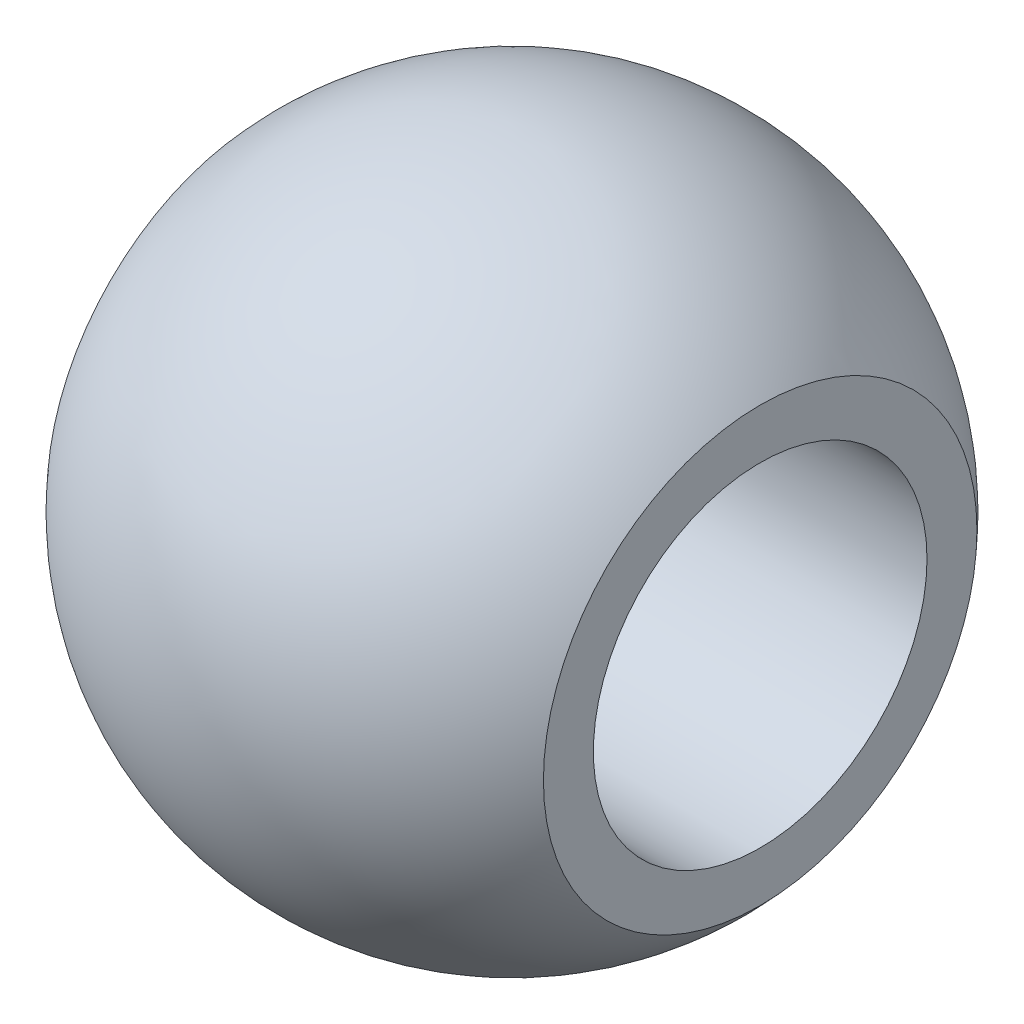
from build123d import *

# Parameters (mm, degrees)
CUT_EXTRUDE2_REACH = 19.794
SKETCH3_R          = 4


with BuildPart() as part:
    # Sketch1 → Revolve1 (revolve)
    with BuildSketch(Plane(origin=(0, 0, 0), x_dir=(0, 0, -1), z_dir=(1, 0, 0))):
        with BuildLine():
            Line((0, -7.9), (0, 0))
            Line((0, 0), (0, 7.9))
            ThreePointArc((0, 7.9), (-7.9, 0), (0, -7.9))
        make_face()
    revolve(axis=Axis((0, 0, 0), (0, 1, 0)))

    # SurfaceCut1
    split(bisect_by=Plane(origin=(5.95, 0, 0), x_dir=(0, 0, -1), z_dir=(1, 0, 0)), keep=Keep.BOTTOM)

    # SurfaceCut2
    split(bisect_by=Plane(origin=(-5.95, 0, 0), x_dir=(0, 0, -1), z_dir=(1, 0, 0)), keep=Keep.TOP)

    # Sketch3 → Cut-Extrude2 (cut, up to next)
    with BuildSketch(Plane(origin=(-5.95, 0, 0), x_dir=(0, 0, -1), z_dir=(1, 0, 0)), mode=Mode.PRIVATE) as cut_extrude2_sk1:
        Circle(SKETCH3_R)
    cut_extrude2_tool1 = extrude(cut_extrude2_sk1.sketch, amount=CUT_EXTRUDE2_REACH, mode=Mode.PRIVATE) & part.part
    add(cut_extrude2_tool1.solids().sort_by_distance((-5.95, 0, 0))[0], mode=Mode.SUBTRACT)


solid = part.part
